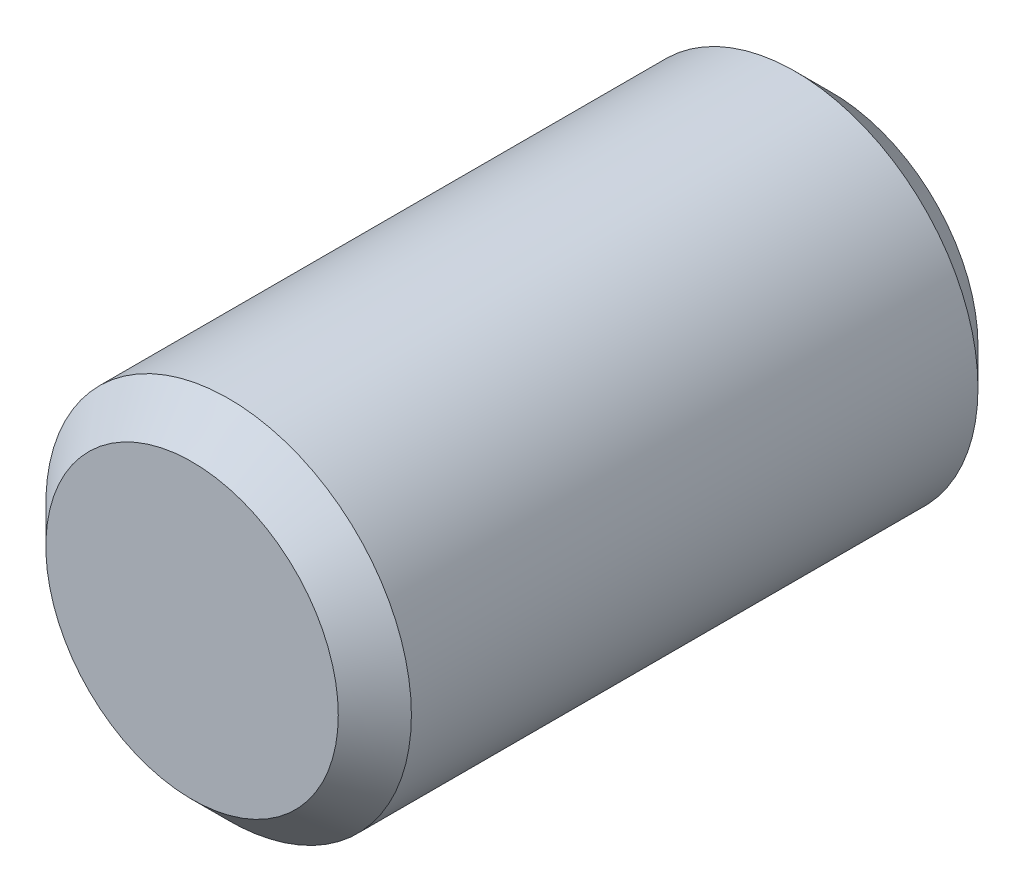
from build123d import *

# Parameters (mm, degrees)
SKETCH1_R           = 5
BOSS_EXTRUDE1_DEPTH = 8.75
CHAMFER1_SIZE       = 1


with BuildPart() as part:
    # Sketch1 → Boss-Extrude1 (new, symmetric)
    with BuildSketch(Plane.XY):
        Circle(SKETCH1_R)
    extrude(amount=BOSS_EXTRUDE1_DEPTH, both=True)

    # Chamfer1
    chamfer1_edges = [part.edges().sort_by_distance(p)[0] for p in [
        (-5, 0, -8.75),
        (-5, 0, 8.75),
    ]]
    chamfer(chamfer1_edges, length=CHAMFER1_SIZE)


solid = part.part
